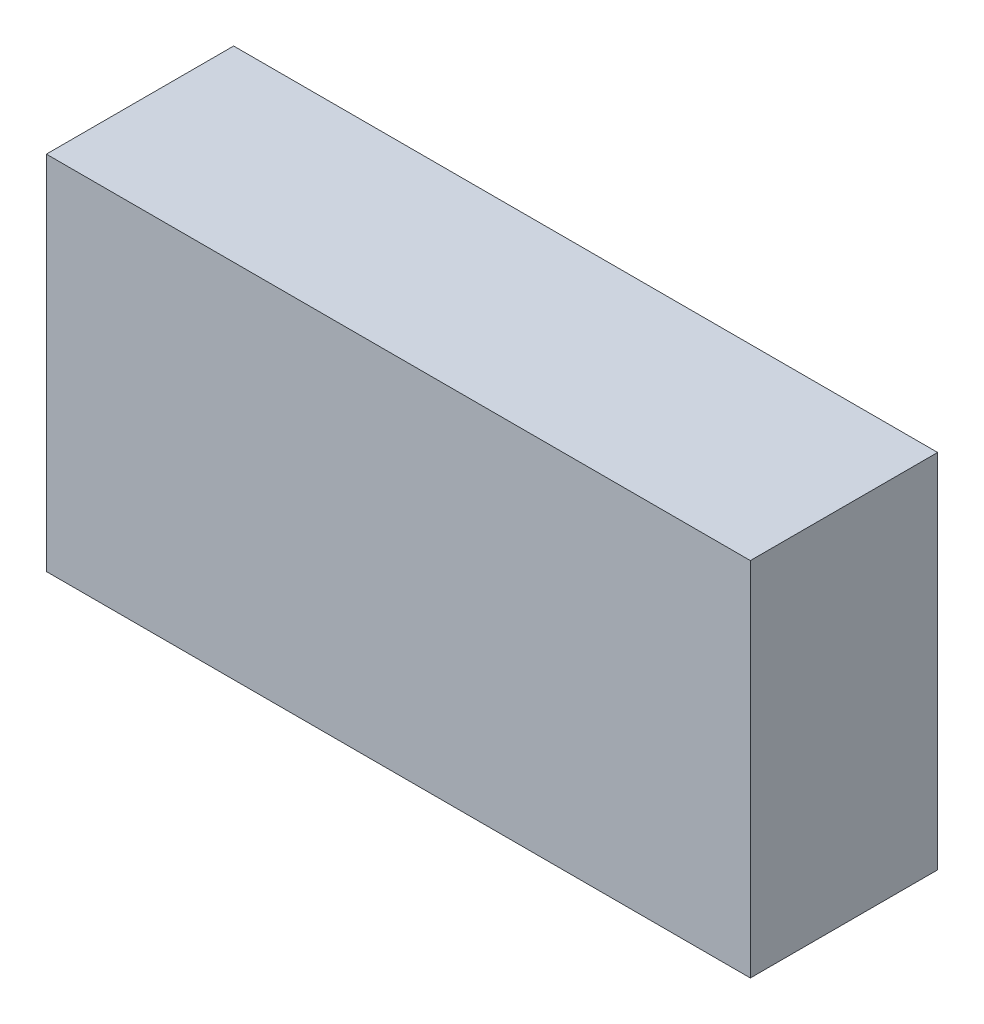
from build123d import *

# Parameters (mm, degrees)
SKETCH1_W               = 3.7592
SKETCH1_H               = 1.9304
COMPONENT_OUTLINE_DEPTH = 1


with BuildPart() as part:
    # Sketch1 → Component_Outline (new body)
    with BuildSketch(Plane.XY):
        with Locations((-0.3556, 0)):
            Rectangle(SKETCH1_W, SKETCH1_H)
    extrude(amount=COMPONENT_OUTLINE_DEPTH)


solid = part.part
